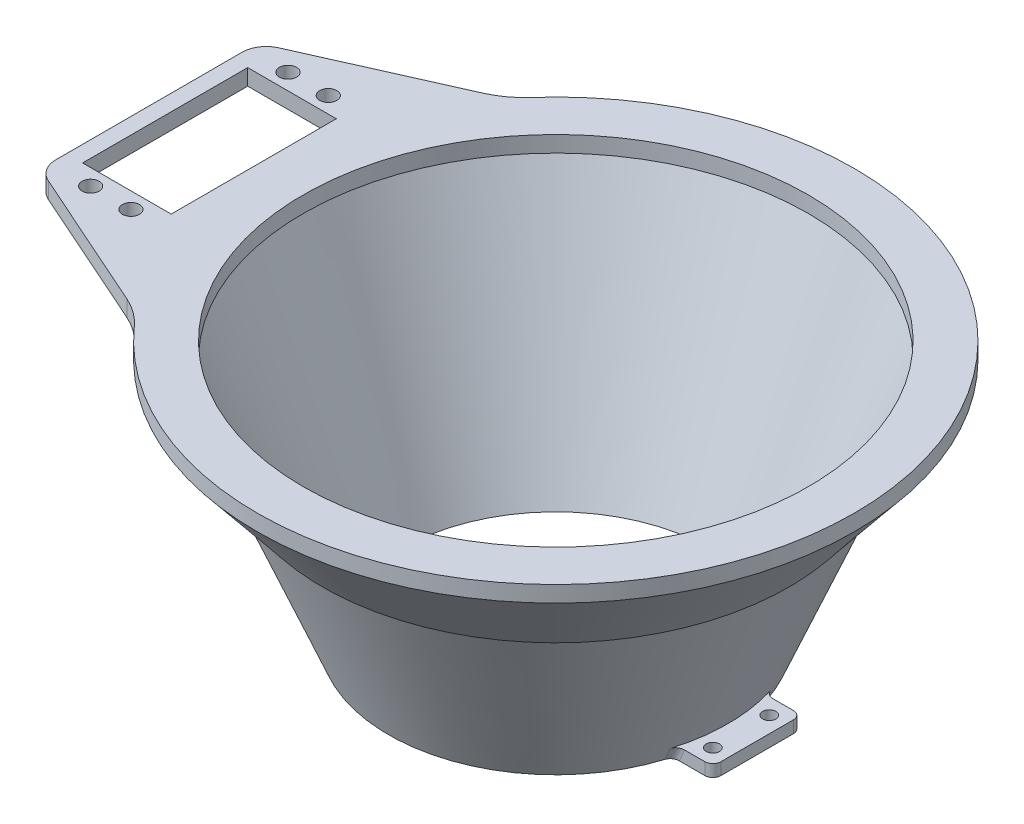
from build123d import *

# Parameters (mm, degrees)
SKETCH3_R           = 1.65
BOSS_EXTRUDE1_DEPTH = 3
FILLET1_R           = 2
SKETCH4_R           = 2.125
SKETCH4_W           = 22
SKETCH4_H           = 41
BOSS_EXTRUDE2_DEPTH = 4
BOSS_EXTRUDE3_DEPTH = 4
FILLET4_R           = 20
FILLET5_R           = 6


with BuildPart() as part:
    # Sketch2 → Revolve1 (revolve)
    with BuildSketch(Plane.XY, mode=Mode.PRIVATE) as revolve1_sk:
        Polygon((38.5, 0), (62.74157355, 60), (66.137606882, 60), (41.5, 0), align=None)
    revolve(revolve1_sk.sketch.rotate(Axis((0, 0, 0), (0, 1, 0)), 90), axis=Axis((0, 0, 0), (0, 1, 0)))

    # Sketch3 → Boss-Extrude1 (add)
    # profile 1 of 2: a face of its own
    with BuildSketch(Plane.XZ):
        with BuildLine():
            Line((-50.015621949, 11), (-40.015621949, 11))
            ThreePointArc((-40.015621949, 11), (-41.5, 0), (-40.015621949, -11))
            Line((-40.015621949, -11), (-50.015621949, -11))
            Line((-50.015621949, -11), (-50.015621949, 11))
        make_face()
        with Locations(Location((-46.015621949, -7, 0), (0, 0, 270))):
            Circle(SKETCH3_R, mode=Mode.SUBTRACT)
        with Locations(Location((-46.015621949, 7, 0), (0, 0, 90))):
            Circle(SKETCH3_R, mode=Mode.SUBTRACT)
    # profile 2 of 2: a face of its own
    with BuildSketch(Plane.XZ):
        with BuildLine():
            Line((50.015621949, -11), (40.015621949, -11))
            ThreePointArc((40.015621949, -11), (41.5, 0), (40.015621949, 11))
            Line((40.015621949, 11), (50.015621949, 11))
            Line((50.015621949, 11), (50.015621949, -11))
        make_face()
        with Locations(Location((46.015621949, 7, 0), (0, 0, 270))):
            Circle(SKETCH3_R, mode=Mode.SUBTRACT)
        with Locations(Location((46.015621949, -7, 0), (0, 0, 90))):
            Circle(SKETCH3_R, mode=Mode.SUBTRACT)
    extrude(amount=-BOSS_EXTRUDE1_DEPTH)

    # Fillet1
    fillet1_edges = [part.edges().sort_by_distance(p)[0] for p in [
        (-40.654005454, 1.499876919, -11),
        (-40.654005454, 1.499876919, 11),
        (-50.015621949, 1.5, -11),
        (-50.015621949, 1.5, 11),
        (40.654005454, 1.499876919, -11),
        (40.654005454, 1.499876919, 11),
        (50.015621949, 1.5, 11),
        (50.015621949, 1.5, -11),
    ]]
    fillet(fillet1_edges, radius=FILLET1_R)



with BuildPart() as body_2:
    # Sketch4 → Boss-Extrude2 (new body)
    with BuildSketch(Plane(origin=(0, 60, 0), x_dir=(1, 0, 0), z_dir=(0, 1, 0))):
        with BuildLine():
            Line((-33.439731634, 57.061084746), (-101, 27))
            Line((-101, 27), (-101, -27))
            Line((-101, -27), (-33.439731634, -57.061084746))
            Line((-33.439731634, -57.061084746), (-20, -63.04112185))
            ThreePointArc((-20, -63.04112185), (66.137606882, 0), (-20, 63.04112185))
            Line((-20, 63.04112185), (-33.439731634, 57.061084746))
        make_face()
        with Locations(Location((-91, -24.5, 0), (0, 0, 270))):
            Circle(SKETCH4_R, mode=Mode.SUBTRACT)
        with Locations(Location((-81, -24.5, 0), (0, 0, 270))):
            Circle(SKETCH4_R, mode=Mode.SUBTRACT)
        with Locations((-86, 0)):
            Rectangle(SKETCH4_W, SKETCH4_H, mode=Mode.SUBTRACT)
        with Locations(Location((-91, 24.5, 0), (0, 0, 270))):
            Circle(SKETCH4_R, mode=Mode.SUBTRACT)
        with Locations(Location((-81, 24.5, 0), (0, 0, 270))):
            Circle(SKETCH4_R, mode=Mode.SUBTRACT)
        with BuildLine():
            ThreePointArc((62.74157355, 0), (36.617438336, -50.947701236), (-20, -59.468521518))
            ThreePointArc((-20, -59.468521518), (-36.617438336, 50.947701236), (62.74157355, 0))
        make_face(mode=Mode.SUBTRACT)
    extrude(amount=BOSS_EXTRUDE2_DEPTH)


with BuildPart() as part_1:
    add(part.part)

    add(body_2.part)  # Revolve5 merges body 2
    # Sketch6 → Revolve5 (revolve)
    with BuildSketch(Plane.XY, mode=Mode.PRIVATE) as revolve5_sk:
        Polygon((-66.137606882, 60), (-74.137606882, 60), (-57.925071255, 40), align=None)
    revolve(revolve5_sk.sketch.rotate(Axis((0, 0, 0), (0, 1, 0)), 162.54936445), axis=Axis((0, 0, 0), (0, 1, 0)))

    # Sketch7 → Boss-Extrude3 (add)
    with BuildSketch(Plane(origin=(0, 60, 0), x_dir=(1, 0, 0), z_dir=(0, 1, 0))):
        with BuildLine():
            Line((-58.055144228, 46.108404688), (-20, 63.04112185))
            ThreePointArc((-20, 63.04112185), (66.137606882, 0), (-20, -63.04112185))
            Line((-20, -63.04112185), (-58.055144228, -46.108404688))
            ThreePointArc((-58.055144228, -46.108404688), (74.137606882, 0), (-58.055144228, 46.108404688))
        make_face()
    extrude(amount=BOSS_EXTRUDE3_DEPTH)

    # Fillet4
    fillet4_edges = [part_1.edges().sort_by_distance(p)[0] for p in [
        (-58.055144228, 62, 46.108404688),
        (-58.055144228, 62, -46.108404688),
    ]]
    fillet(fillet4_edges, radius=FILLET4_R)

    # Fillet5
    fillet5_edges = [part_1.edges().sort_by_distance(p)[0] for p in [
        (-101, 62, -27),
        (-101, 62, 27),
    ]]
    fillet(fillet5_edges, radius=FILLET5_R)


solid = part_1.part
